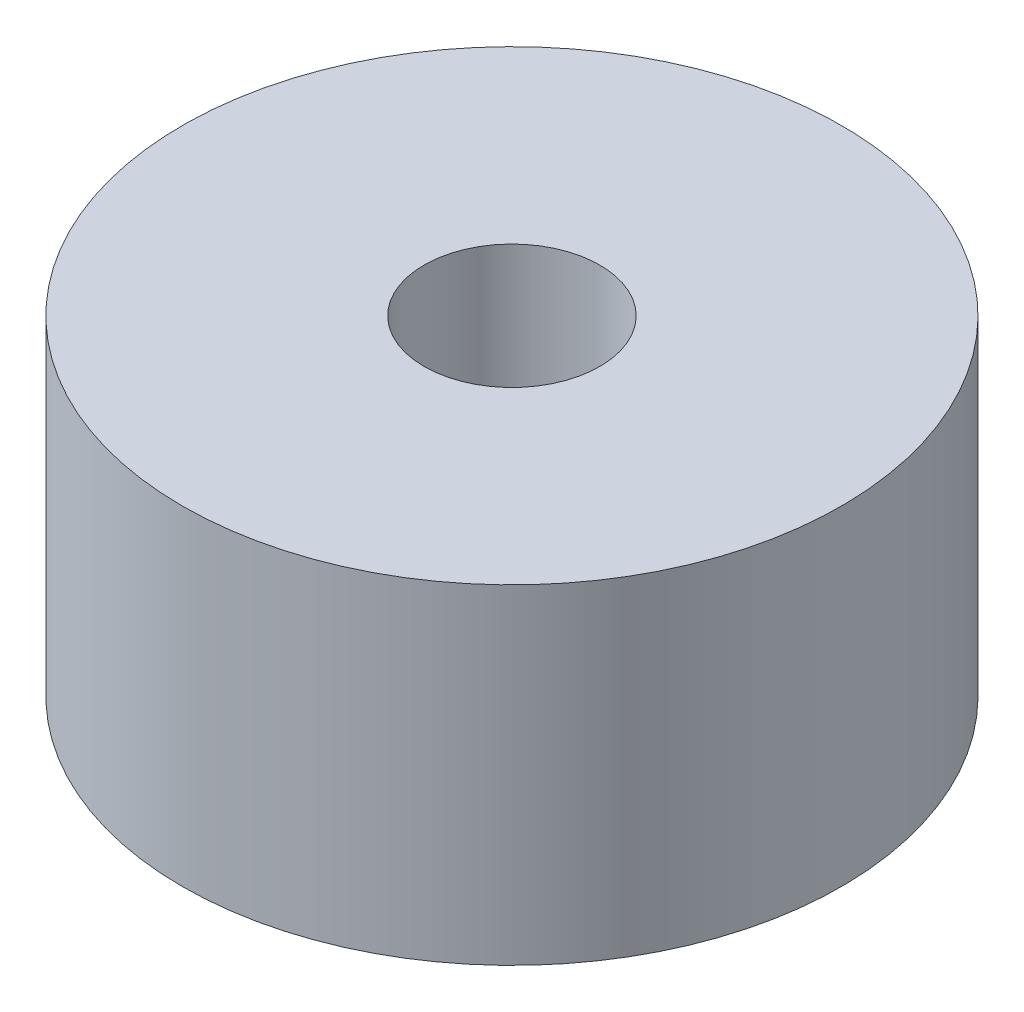
from build123d import *

# Parameters (mm, degrees)
SKETCH2_R           = 15
BOSS_EXTRUDE1_DEPTH = 15
SKETCH3_R           = 4
CUT_EXTRUDE1_DEPTH  = 10


with BuildPart() as part:
    # Sketch2 → Boss-Extrude1 (new body)
    with BuildSketch(Plane(origin=(0, 0, 0), x_dir=(1, 0, 0), z_dir=(0, 1, 0))):
        with Locations(Location((0, 0, 0), (0, 0, 270))):
            Circle(SKETCH2_R)
    extrude(amount=BOSS_EXTRUDE1_DEPTH)

    # Sketch3 → Cut-Extrude1 (cut)
    with BuildSketch(Plane(origin=(0, 15, 0), x_dir=(1, 0, 0), z_dir=(0, 1, 0))):
        with Locations(Location((0, 0, 0), (0, 0, 270))):
            Circle(SKETCH3_R)
    extrude(amount=-CUT_EXTRUDE1_DEPTH, mode=Mode.SUBTRACT)


solid = part.part
